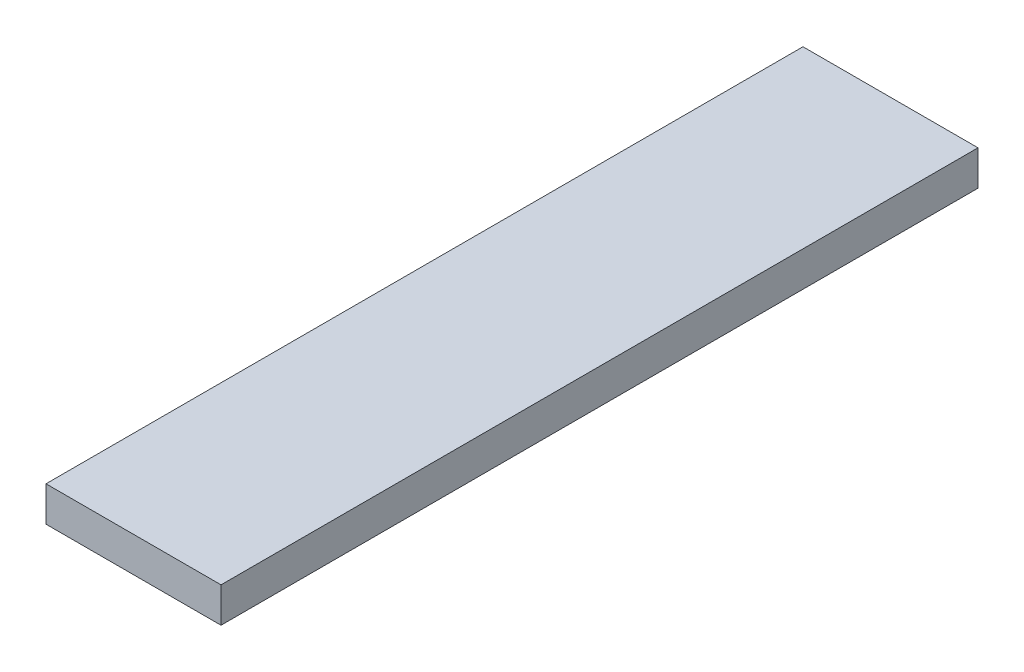
from build123d import *

# Parameters (mm, degrees)
SKETCH_1_W      = 200
SKETCH_1_H      = 40
EXTRUDE_1_DEPTH = 865


with BuildPart() as part:
    # Эскиз1 → Бобышка-Вытянуть1 (new body)
    with BuildSketch(Plane.XY):
        with Locations((-100, 20)):
            Rectangle(SKETCH_1_W, SKETCH_1_H)
    extrude(amount=-EXTRUDE_1_DEPTH)


solid = part.part
